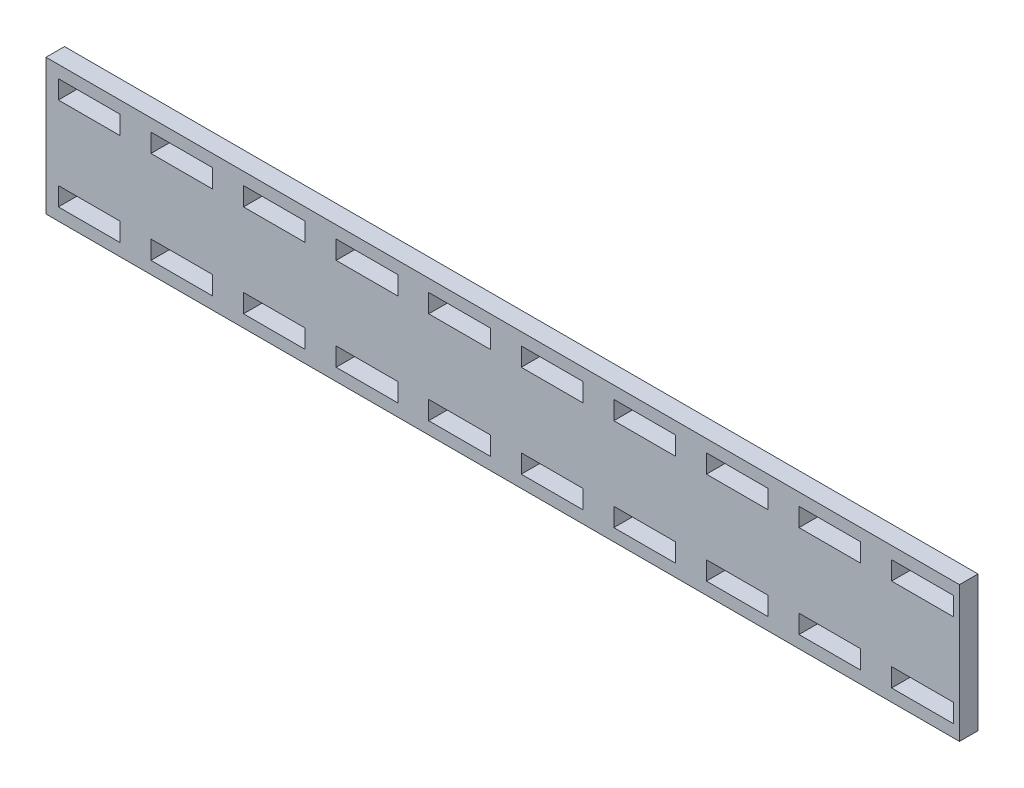
from build123d import *

# Parameters (mm, degrees)
SKETCH_1_W      = 148
SKETCH_1_H      = 22
SKETCH_1_W_2    = 10
SKETCH_1_H_2    = 3
EXTRUDE_1_DEPTH = 3


with BuildPart() as part:
    # 草图1 → 凸台-拉伸1 (new body)
    with BuildSketch(Plane.XY):
        Rectangle(SKETCH_1_W, SKETCH_1_H)
        with Locations((-52, 7.5)):
            Rectangle(SKETCH_1_W_2, SKETCH_1_H_2, mode=Mode.SUBTRACT)
        with Locations((-67, 7.5)):
            Rectangle(SKETCH_1_W_2, SKETCH_1_H_2, mode=Mode.SUBTRACT)
        with Locations((-37, 7.5)):
            Rectangle(SKETCH_1_W_2, SKETCH_1_H_2, mode=Mode.SUBTRACT)
        with Locations((-22, 7.5)):
            Rectangle(SKETCH_1_W_2, SKETCH_1_H_2, mode=Mode.SUBTRACT)
        with Locations((-7, 7.5)):
            Rectangle(SKETCH_1_W_2, SKETCH_1_H_2, mode=Mode.SUBTRACT)
        with Locations((8, 7.5)):
            Rectangle(SKETCH_1_W_2, SKETCH_1_H_2, mode=Mode.SUBTRACT)
        with Locations((23, 7.5)):
            Rectangle(SKETCH_1_W_2, SKETCH_1_H_2, mode=Mode.SUBTRACT)
        with Locations((38, 7.5)):
            Rectangle(SKETCH_1_W_2, SKETCH_1_H_2, mode=Mode.SUBTRACT)
        with Locations((53, 7.5)):
            Rectangle(SKETCH_1_W_2, SKETCH_1_H_2, mode=Mode.SUBTRACT)
        with Locations((68, 7.5)):
            Rectangle(SKETCH_1_W_2, SKETCH_1_H_2, mode=Mode.SUBTRACT)
        with Locations((68, -7.5)):
            Rectangle(SKETCH_1_W_2, SKETCH_1_H_2, mode=Mode.SUBTRACT)
        with Locations((53, -7.5)):
            Rectangle(SKETCH_1_W_2, SKETCH_1_H_2, mode=Mode.SUBTRACT)
        with Locations((38, -7.5)):
            Rectangle(SKETCH_1_W_2, SKETCH_1_H_2, mode=Mode.SUBTRACT)
        with Locations((23, -7.5)):
            Rectangle(SKETCH_1_W_2, SKETCH_1_H_2, mode=Mode.SUBTRACT)
        with Locations((8, -7.5)):
            Rectangle(SKETCH_1_W_2, SKETCH_1_H_2, mode=Mode.SUBTRACT)
        with Locations((-7, -7.5)):
            Rectangle(SKETCH_1_W_2, SKETCH_1_H_2, mode=Mode.SUBTRACT)
        with Locations((-22, -7.5)):
            Rectangle(SKETCH_1_W_2, SKETCH_1_H_2, mode=Mode.SUBTRACT)
        with Locations((-37, -7.5)):
            Rectangle(SKETCH_1_W_2, SKETCH_1_H_2, mode=Mode.SUBTRACT)
        with Locations((-52, -7.5)):
            Rectangle(SKETCH_1_W_2, SKETCH_1_H_2, mode=Mode.SUBTRACT)
        with Locations((-67, -7.5)):
            Rectangle(SKETCH_1_W_2, SKETCH_1_H_2, mode=Mode.SUBTRACT)
    extrude(amount=EXTRUDE_1_DEPTH)


solid = part.part
